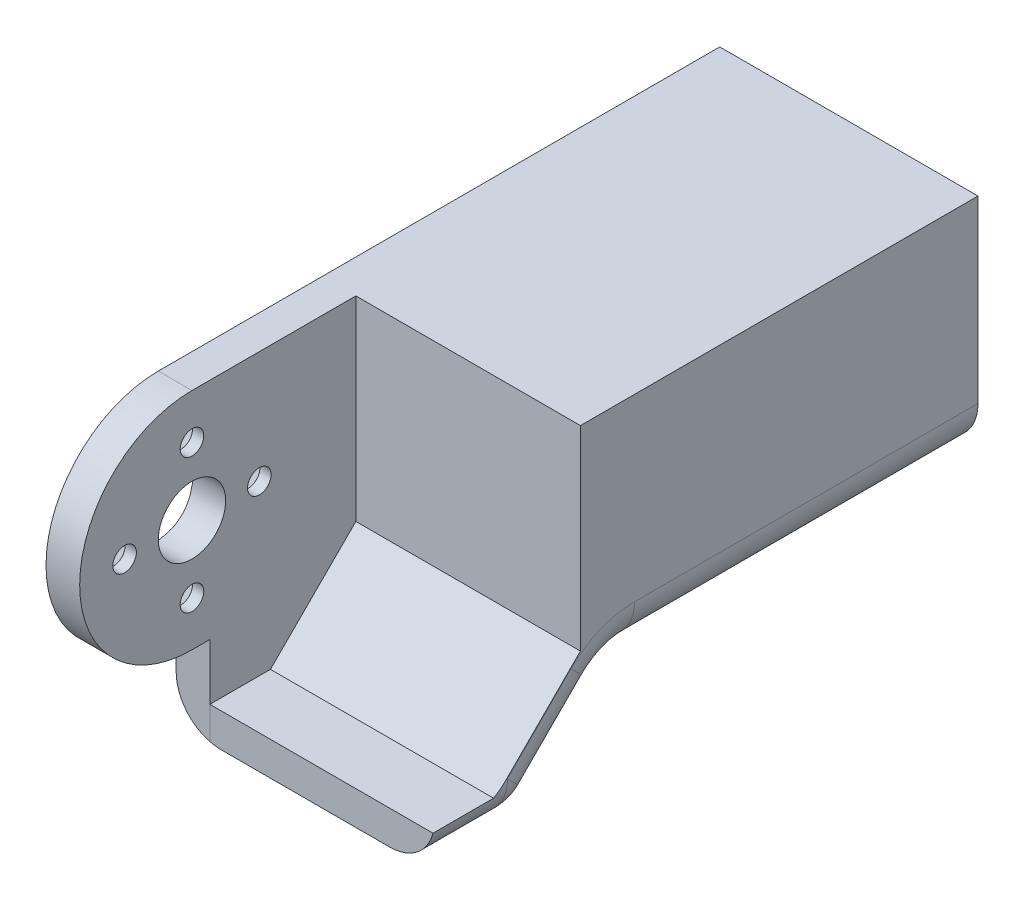
from build123d import *

# Parameters (mm, degrees)
SKETCH1_W                            = 48.407195654
SKETCH1_H                            = 28
BOSS_EXTRUDE1_DEPTH                  = 20
BOSS_EXTRUDE2_DEPTH                  = 3
CUT_EXTRUDE1_DEPTH                   = 20
CUT_EXTRUDE2_DEPTH                   = 266.217617444
F_6_0_6_DIAMETER_HOLE1_D             = 6
F_2_1_2_1_DIAMETER_HOLE1_D           = 2.1
F_2_1_2_1_DIAMETER_HOLE1_DEPTH       = 23
F_2_1_2_1_DIAMETER_HOLE1_CSINK_D     = 6.1
F_2_1_2_1_DIAMETER_HOLE1_CSINK_ANGLE = 90
FILLET1_R                            = 4


with BuildPart() as part:
    # Sketch1 → Boss-Extrude1 (new body)
    with BuildSketch(Plane(origin=(15.537250863, 0, 0), x_dir=(0, 0, -1), z_dir=(1, 0, 0))):
        with Locations((-95.430589359, 215.326974637)):
            Rectangle(SKETCH1_W, SKETCH1_H)
    extrude(amount=-BOSS_EXTRUDE1_DEPTH)

    # Sketch2 → Boss-Extrude2 (add)
    with BuildSketch(Plane.ZY.offset(4.462749137)):
        with BuildLine():
            Line((71.226991532, 201.326974637), (71.226991532, 229.326974637))
            Line((71.226991532, 229.326974637), (121.226991532, 229.326974637))
            ThreePointArc((121.226991532, 229.326974637), (131.226991532, 219.326974637), (121.226991532, 209.326974637))
            Line((121.226991532, 209.326974637), (119.634236905, 209.326974637))
            Line((119.634236905, 209.326974637), (119.634236905, 201.326974637))
            Line((119.634236905, 201.326974637), (71.226991532, 201.326974637))
        make_face()
    extrude(amount=BOSS_EXTRUDE2_DEPTH)

    # Sketch3 → Cut-Extrude1 (cut)
    with BuildSketch(Plane(origin=(15.537250863, 0, 0), x_dir=(0, 0, -1), z_dir=(1, 0, 0))):
        Polygon((-106.634187186, 211.932705929), (-106.634187186, 229.326974637), (-119.634187186, 229.326974637), (-119.634187186, 204.326974637), (-114.239918478, 204.326974637), align=None)
    extrude(amount=-CUT_EXTRUDE1_DEPTH, mode=Mode.SUBTRACT)

    # Sketch4 → Cut-Extrude2 (cut, through all)
    with BuildSketch(Plane.ZY.offset(7.462749137)):
        Polygon((71.226991532, 201.326974637), (111.468236905, 201.326974637), (103.468236905, 209.326974637), (71.226991532, 209.326974637), align=None)
    extrude(amount=-CUT_EXTRUDE2_DEPTH, mode=Mode.SUBTRACT)

    # Ø6.0 (6) Diameter Hole1 (through all)
    with Locations(Plane(origin=(-4.462749137, 0, 0), x_dir=(0, 0, -1), z_dir=(1, 0, 0))):
        with Locations((-121.226991532, 219.326974637)):
            Hole(F_6_0_6_DIAMETER_HOLE1_D / 2)

    # Ø2.1 (2.1) Diameter Hole1
    with Locations(Plane.ZY.offset(7.462749137)):
        with Locations((121.226991532, 225.326974637), (127.226991532, 219.326974637), (121.226991532, 213.326974637), (115.226991532, 219.326974637)):
            CounterSinkHole(F_2_1_2_1_DIAMETER_HOLE1_D / 2, F_2_1_2_1_DIAMETER_HOLE1_CSINK_D / 2, depth=F_2_1_2_1_DIAMETER_HOLE1_DEPTH, counter_sink_angle=F_2_1_2_1_DIAMETER_HOLE1_CSINK_ANGLE)

    # Fillet1
    fillet1_edges = [part.edges().sort_by_distance(p)[0] for p in [
        (15.537250863, 201.326974637, 115.551212045),
        (15.537250863, 209.326974637, 87.347614218),
        (15.537250863, 205.326974637, 107.468236905),
        (-7.462749137, 201.326974637, 115.551236905),
        (4.037250863, 201.326974637, 111.468236905),
        (-7.462749137, 205.326974637, 107.468236905),
        (-7.462749137, 209.326974637, 87.347614218),
        (4.037250863, 209.326974637, 103.468236905),
    ]]
    fillet(fillet1_edges, radius=FILLET1_R)


solid = part.part
